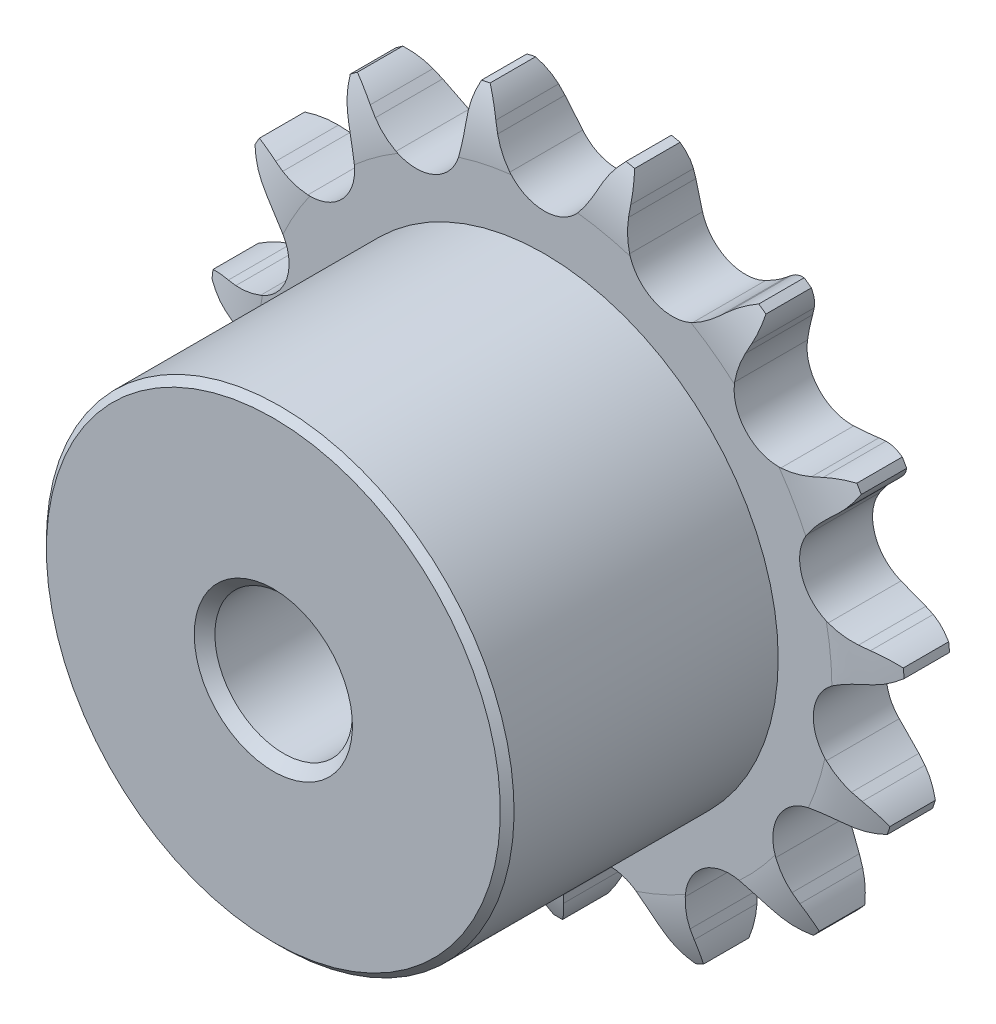
from build123d import *

# Parameters (mm, degrees)
CUT_EXTRUDE1_DEPTH      = 36.825846038
CIRPATTERN1_COUNT       = 15
BOSS_EXTRUDE1_START     = 2.65
SKETCH2_R               = 17
BOSS_EXTRUDE1_DEPTH     = 19.7
CUT_EXTRUDE2_DEPTH      = 43.078507849
CUT_EXTRUDE2_DEPTH_BACK = 43.078507849
SKETCH3_R               = 5
SKETCH4_W               = 44.7
SKETCH4_H               = 44.7


with BuildPart() as part:
    # Sketch1 → Revolve1 (revolve)
    with BuildSketch(Plane(origin=(0, 0, 0), x_dir=(0, 0, -1), z_dir=(1, 0, 0))):
        with BuildLine():
            Line((2.65, 0), (-2.65, 0))
            Line((-2.65, 0), (-2.65, 20.904401953))
            ThreePointArc((-2.65, 20.904401953), (-2.396794345, 23.14046993), (-1.65, 25.263300896))
            Line((-1.65, 25.263300896), (1.65, 25.263300896))
            ThreePointArc((1.65, 25.263300896), (2.396794345, 23.14046993), (2.65, 20.904401953))
            Line((2.65, 20.904401953), (2.65, 0))
        make_face()
    revolve(axis=Axis((0, 0, -2.65), (0, 0, 1)))

    # Sketch0 → Cut-Extrude1 (cut, symmetric)
    with BuildSketch(Plane.XY):
        with BuildLine():
            Line((8.647797918, -21.95125494), (8.22459617, -21.38417506))
            ThreePointArc((8.22459617, -21.38417506), (7.555944454, -20.595728019), (6.79455981, -19.896416015))
            ThreePointArc((6.79455981, -19.896416015), (4.091158348, -19.247386747), (1.885462209, -20.939876922))
            ThreePointArc((1.885462209, -20.939876922), (1.474338542, -21.888413261), (1.184185106, -22.880660628))
            Line((1.184185106, -22.880660628), (1.028223239, -23.570845535))
            ThreePointArc((1.028223239, -23.570845535), (-1.216701219, -26.817836887), (-5.085099397, -27.604051998))
            ThreePointArc((-5.085099397, -27.604051998), (5.83577385, -27.455157369), (15.873048901, -23.149260057))
            ThreePointArc((15.873048901, -23.149260057), (12.019308822, -24.004436102), (8.647797918, -21.95125494))
        make_face()
    cut_extrude1 = extrude(amount=CUT_EXTRUDE1_DEPTH, both=True, mode=Mode.SUBTRACT)

    # CirPattern1: Cut-Extrude1 ×15 about axis
    cirpattern1_axis = Axis((0, 0, 0), (0, 0, 1))
    for i in range(1, CIRPATTERN1_COUNT):
        add(cut_extrude1.rotate(cirpattern1_axis, i * 360 / CIRPATTERN1_COUNT), mode=Mode.SUBTRACT)

    # Sketch2 → Boss-Extrude1 (add)
    with BuildSketch(Plane.XY.offset(BOSS_EXTRUDE1_START)):
        with Locations(Location((0, 0, 0), (0, 0, 270))):
            Circle(SKETCH2_R)
    extrude(amount=BOSS_EXTRUDE1_DEPTH)

    # Sketch3 → Cut-Extrude2 (cut, two sides: drawn at the far end of the back side and taken through both)
    with BuildSketch(Plane.XY.offset(-CUT_EXTRUDE2_DEPTH_BACK)):
        with Locations(Location((0, 0, 0), (0, 0, 180))):
            Circle(SKETCH3_R)
    extrude(amount=CUT_EXTRUDE2_DEPTH + CUT_EXTRUDE2_DEPTH_BACK, mode=Mode.SUBTRACT)

    # Sketch4 → Cut-Revolve1 (revolve, cut)
    with BuildSketch(Plane(origin=(0, 0, 0), x_dir=(0, 0, -1), z_dir=(1, 0, 0))):
        Polygon((-22.35, 17), (-22.35, 16.5), (-21.85, 17), align=None)
        Polygon((-22.35, 5), (-22.35, 5.75), (-21.6, 5), align=None)
        Polygon((1.9, 5), (2.65, 5), (2.65, 5.75), align=None)
        with Locations((0, 47.613300896)):
            Rectangle(SKETCH4_W, SKETCH4_H)
    revolve(axis=Axis((0, 0, -2.65), (0, 0, 1)), mode=Mode.SUBTRACT)


solid = part.part
